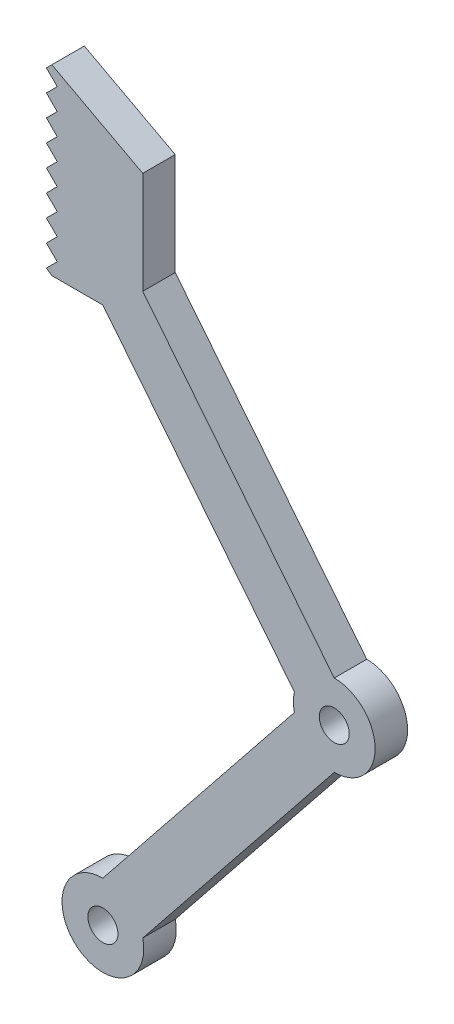
from build123d import *

# Parameters (mm, degrees)
BOSS_EXTRUDE1_DEPTH = 3.18
SKETCH2_R           = 1.47
CUT_EXTRUDE1_DEPTH  = 76.406636354


with BuildPart() as part:
    # Sketch1 → Boss-Extrude1 (new body)
    with BuildSketch(Plane.XY):
        with BuildLine():
            Line((0, 4), (18.75, 27.418742494))
            ThreePointArc((18.75, 27.418742494), (18.653123749, 28.293742494), (18.75, 29.168742494))
            Line((18.75, 29.168742494), (0, 52.587484988))
            Line((0, 52.587484988), (-5, 52.587484988))
            Line((-5, 52.587484988), (-5.530330085, 52.96527181))
            Line((-5.530330085, 52.96527181), (-4.469669914, 54.025931982))
            Line((-4.469669914, 54.025931982), (-5.530330085, 55.086592153))
            Line((-5.530330085, 55.086592153), (-4.469669914, 56.147252325))
            Line((-4.469669914, 56.147252325), (-5.530330086, 57.207912497))
            Line((-5.530330086, 57.207912497), (-4.469669914, 58.268572669))
            Line((-4.469669914, 58.268572669), (-5.530330086, 59.32923284))
            Line((-5.530330086, 59.32923284), (-4.469669914, 60.389893012))
            Line((-4.469669914, 60.389893012), (-5.530330086, 61.450553184))
            Line((-5.530330086, 61.450553184), (-4.469669914, 62.511213356))
            Line((-4.469669914, 62.511213356), (-5.530330086, 63.571873527))
            Line((-5.530330086, 63.571873527), (-4.469669914, 64.632533699))
            Line((-4.469669914, 64.632533699), (-5.530330086, 65.693193871))
            Line((-5.530330086, 65.693193871), (-4.469669914, 66.753854043))
            Line((-4.469669914, 66.753854043), (-5.530330086, 67.814514215))
            Line((-5.530330086, 67.814514215), (-4.469669914, 68.875174386))
            Line((-4.469669914, 68.875174386), (-5.530330086, 69.935834558))
            Line((-5.530330086, 69.935834558), (-5.000000002, 70.467435037))
            Line((-5.000000002, 70.467435037), (3.903123749, 65.712484988))
            Line((3.903123749, 65.712484988), (3.903123749, 55.712484988))
            Line((3.903123749, 55.712484988), (22.653123749, 32.293742494))
            ThreePointArc((22.653123749, 32.293742494), (26.653123749, 28.293742494), (22.653123749, 24.293742494))
            Line((22.653123749, 24.293742494), (3.903123749, 0.875))
            ThreePointArc((3.903123749, 0.875), (-2.5, -3.122498999), (0, 4))
        make_face()
    extrude(amount=BOSS_EXTRUDE1_DEPTH)

    # Sketch2 → Cut-Extrude1 (cut, through all)
    with BuildSketch(Plane.XY.offset(3.18)):
        with Locations((22.653123749, 28.293742494)):
            Circle(SKETCH2_R)
        Circle(SKETCH2_R)
    extrude(amount=-CUT_EXTRUDE1_DEPTH, mode=Mode.SUBTRACT)


solid = part.part
